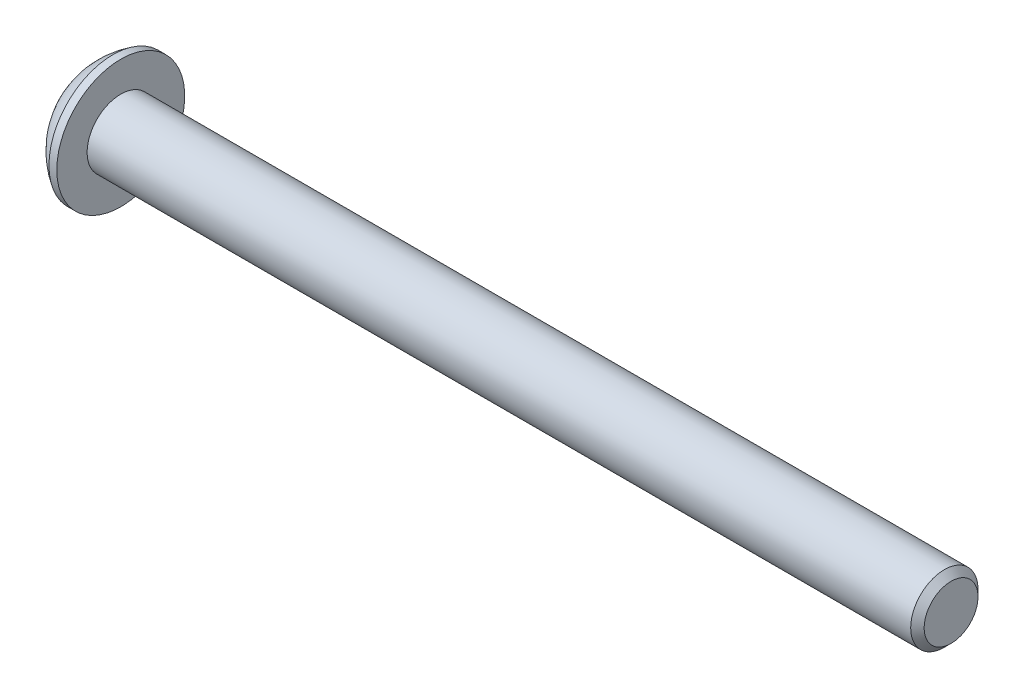
from build123d import *

# Parameters (mm, degrees)
CHAMFER1_SIZE      = 0.3
CUT_EXTRUDE1_DEPTH = 1


with BuildPart() as part:
    # Sketch1 → Revolve1 (revolve)
    with BuildSketch(Plane.XY, mode=Mode.PRIVATE) as revolve1_sk:
        with BuildLine():
            Line((0, 1.43), (0, 0))
            Line((0, 0), (38.65, 0))
            Line((38.65, 0), (38.65, 1.5))
            Line((38.65, 1.5), (1.65, 1.5))
            Line((1.65, 1.5), (1.65, 2.85))
            Line((1.65, 2.85), (1.3, 2.85))
            ThreePointArc((1.3, 2.85), (0.550445176, 2.231141741), (0, 1.43))
        make_face()
    revolve(revolve1_sk.sketch.rotate(Axis((0, 0, 0), (1, 0, 0)), 90), axis=Axis((0, 0, 0), (1, 0, 0)))

    # Chamfer1
    chamfer1_edges = [part.edges().sort_by_distance(p)[0] for p in [
        (38.65, 0, -1.5),
    ]]
    chamfer(chamfer1_edges, length=CHAMFER1_SIZE)

    # Sketch2 → Cut-Extrude1 (cut)
    with BuildSketch(Plane.ZY):
        Polygon((0, 1.154700538), (-1, 0.577350269), (-1, -0.577350269), (0, -1.154700538), (1, -0.577350269), (1, 0.577350269), align=None)
    extrude(amount=-CUT_EXTRUDE1_DEPTH, mode=Mode.SUBTRACT)


solid = part.part
